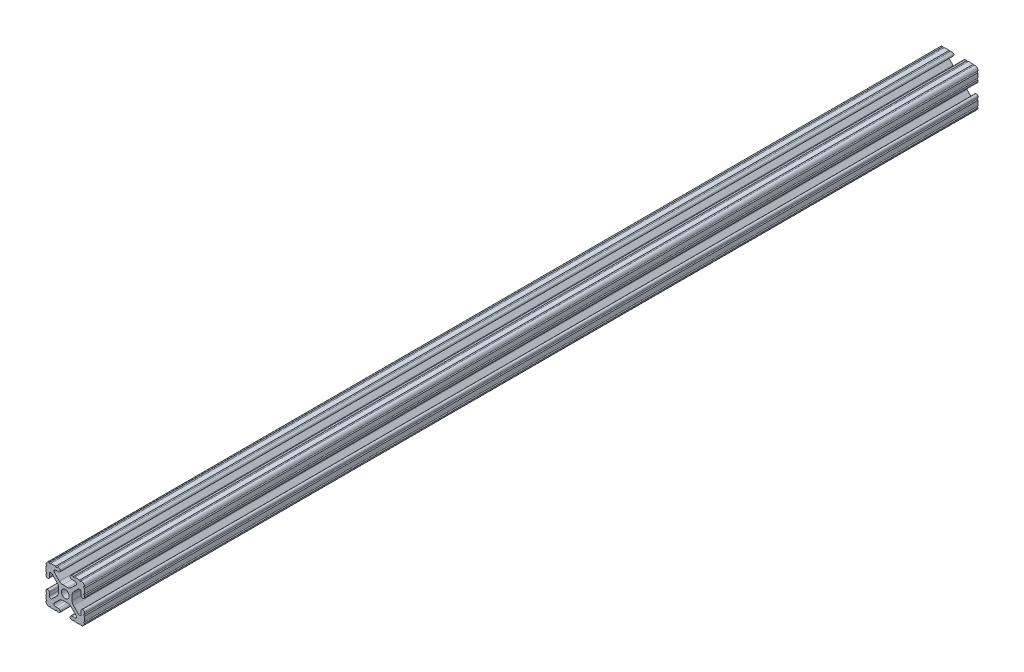
from build123d import *

# Parameters (mm, degrees)
SKETCH1_R           = 2.6035
BOSS_EXTRUDE1_DEPTH = 590.55


with BuildPart() as part:
    # Sketch1 → Boss-Extrude1 (new body)
    with BuildSketch(Plane.XY):
        with BuildLine():
            Line((-12.7, -6.3330836), (-12.7, -9.5504))
            ThreePointArc((-12.7, -9.5504), (-12.192000006, -10.058323491), (-12.699846982, -10.566399977))
            ThreePointArc((-12.699846982, -10.566399977), (-12.082522516, -12.082522516), (-10.566399977, -12.699846982))
            ThreePointArc((-10.566399977, -12.699846982), (-10.058323491, -12.192000006), (-9.5504, -12.7))
            Line((-9.5504, -12.7), (-6.3330836, -12.7))
            ThreePointArc((-6.3330836, -12.7), (-5.8250836, -12.192), (-5.3170836, -12.7))
            Line((-5.3170836, -12.7), (-4.343399971, -12.7))
            ThreePointArc((-4.343399971, -12.7), (-3.238499971, -11.5951), (-4.343399971, -10.4902))
            Line((-4.343399971, -10.4902), (-6.474794456, -10.4902))
            ThreePointArc((-6.474794456, -10.4902), (-7.413456061, -9.863006367), (-7.193214945, -8.75577951))
            Line((-7.193214945, -8.75577951), (-3.863171405, -5.42573597))
            ThreePointArc((-3.863171405, -5.42573597), (-2.833127272, -4.737482484), (-1.618107374, -4.4958))
            Line((-1.618107374, -4.4958), (1.618107374, -4.4958))
            ThreePointArc((1.618107374, -4.4958), (2.833127272, -4.737482484), (3.863171405, -5.42573597))
            Line((3.863171405, -5.42573597), (7.193214945, -8.75577951))
            ThreePointArc((7.193214945, -8.75577951), (7.413456061, -9.863006367), (6.474794456, -10.4902))
            Line((6.474794456, -10.4902), (4.3434, -10.4902))
            ThreePointArc((4.3434, -10.4902), (3.2385, -11.5951), (4.3434, -12.7))
            Line((4.3434, -12.7), (5.3170836, -12.7))
            ThreePointArc((5.3170836, -12.7), (5.8250836, -12.192), (6.3330836, -12.7))
            Line((6.3330836, -12.7), (9.5504, -12.7))
            ThreePointArc((9.5504, -12.7), (10.058323491, -12.192000006), (10.566399977, -12.699846982))
            ThreePointArc((10.566399977, -12.699846982), (12.082522516, -12.082522516), (12.699846982, -10.566399977))
            ThreePointArc((12.699846982, -10.566399977), (12.192000006, -10.058323491), (12.7, -9.5504))
            Line((12.7, -9.5504), (12.7, -6.3330836))
            ThreePointArc((12.7, -6.3330836), (12.192, -5.8250836), (12.7, -5.3170836))
            Line((12.7, -5.3170836), (12.7, -4.343399971))
            ThreePointArc((12.7, -4.343399971), (11.5951, -3.238499971), (10.4902, -4.343399971))
            Line((10.4902, -4.343399971), (10.4902, -6.474794456))
            ThreePointArc((10.4902, -6.474794456), (9.863006367, -7.413456061), (8.75577951, -7.193214945))
            Line((8.75577951, -7.193214945), (5.42573597, -3.863171405))
            ThreePointArc((5.42573597, -3.863171405), (4.737482484, -2.833127272), (4.4958, -1.618107374))
            Line((4.4958, -1.618107374), (4.4958, 1.618107374))
            ThreePointArc((4.4958, 1.618107374), (4.737482484, 2.833127272), (5.42573597, 3.863171405))
            Line((5.42573597, 3.863171405), (8.75577951, 7.193214945))
            ThreePointArc((8.75577951, 7.193214945), (9.863006367, 7.413456061), (10.4902, 6.474794456))
            Line((10.4902, 6.474794456), (10.4902, 4.3434))
            ThreePointArc((10.4902, 4.3434), (11.5951, 3.2385), (12.7, 4.3434))
            Line((12.7, 4.3434), (12.7, 5.3170836))
            ThreePointArc((12.7, 5.3170836), (12.192, 5.8250836), (12.7, 6.3330836))
            Line((12.7, 6.3330836), (12.7, 9.5504))
            ThreePointArc((12.7, 9.5504), (12.192000006, 10.058323491), (12.699846982, 10.566399977))
            ThreePointArc((12.699846982, 10.566399977), (12.082522516, 12.082522516), (10.566399977, 12.699846982))
            ThreePointArc((10.566399977, 12.699846982), (10.058323491, 12.192000006), (9.5504, 12.7))
            Line((9.5504, 12.7), (6.3330836, 12.7))
            ThreePointArc((6.3330836, 12.7), (5.8250836, 12.192), (5.3170836, 12.7))
            Line((5.3170836, 12.7), (4.343399971, 12.7))
            ThreePointArc((4.343399971, 12.7), (3.238499971, 11.5951), (4.343399971, 10.4902))
            Line((4.343399971, 10.4902), (6.474794456, 10.4902))
            ThreePointArc((6.474794456, 10.4902), (7.413456061, 9.863006367), (7.193214945, 8.75577951))
            Line((7.193214945, 8.75577951), (3.863171405, 5.42573597))
            ThreePointArc((3.863171405, 5.42573597), (2.833127272, 4.737482484), (1.618107374, 4.4958))
            Line((1.618107374, 4.4958), (-1.618107374, 4.4958))
            ThreePointArc((-1.618107374, 4.4958), (-2.833127272, 4.737482484), (-3.863171405, 5.42573597))
            Line((-3.863171405, 5.42573597), (-7.193214945, 8.75577951))
            ThreePointArc((-7.193214945, 8.75577951), (-7.413456061, 9.863006367), (-6.474794456, 10.4902))
            Line((-6.474794456, 10.4902), (-4.3434, 10.4902))
            ThreePointArc((-4.3434, 10.4902), (-3.2385, 11.5951), (-4.3434, 12.7))
            Line((-4.3434, 12.7), (-5.3170836, 12.7))
            ThreePointArc((-5.3170836, 12.7), (-5.8250836, 12.192), (-6.3330836, 12.7))
            Line((-6.3330836, 12.7), (-9.5504, 12.7))
            ThreePointArc((-9.5504, 12.7), (-10.058323491, 12.192000006), (-10.566399977, 12.699846982))
            ThreePointArc((-10.566399977, 12.699846982), (-12.082522516, 12.082522516), (-12.699846982, 10.566399977))
            ThreePointArc((-12.699846982, 10.566399977), (-12.192000006, 10.058323491), (-12.7, 9.5504))
            Line((-12.7, 9.5504), (-12.7, 6.3330836))
            ThreePointArc((-12.7, 6.3330836), (-12.192, 5.8250836), (-12.7, 5.3170836))
            Line((-12.7, 5.3170836), (-12.7, 4.343399971))
            ThreePointArc((-12.7, 4.343399971), (-11.5951, 3.238499971), (-10.4902, 4.343399971))
            Line((-10.4902, 4.343399971), (-10.4902, 6.474794456))
            ThreePointArc((-10.4902, 6.474794456), (-9.863006367, 7.413456061), (-8.75577951, 7.193214945))
            Line((-8.75577951, 7.193214945), (-5.42573597, 3.863171405))
            ThreePointArc((-5.42573597, 3.863171405), (-4.737482484, 2.833127272), (-4.4958, 1.618107374))
            Line((-4.4958, 1.618107374), (-4.4958, -1.618107374))
            ThreePointArc((-4.4958, -1.618107374), (-4.737482484, -2.833127272), (-5.42573597, -3.863171405))
            Line((-5.42573597, -3.863171405), (-8.75577951, -7.193214945))
            ThreePointArc((-8.75577951, -7.193214945), (-9.863006367, -7.413456061), (-10.4902, -6.474794456))
            Line((-10.4902, -6.474794456), (-10.4902, -4.3434))
            ThreePointArc((-10.4902, -4.3434), (-11.5951, -3.2385), (-12.7, -4.3434))
            Line((-12.7, -4.3434), (-12.7, -5.3170836))
            ThreePointArc((-12.7, -5.3170836), (-12.192, -5.8250836), (-12.7, -6.3330836))
        make_face()
        with Locations(Location((0, 0, 0), (0, 0, 180))):
            Circle(SKETCH1_R, mode=Mode.SUBTRACT)
    extrude(amount=-BOSS_EXTRUDE1_DEPTH)


solid = part.part
